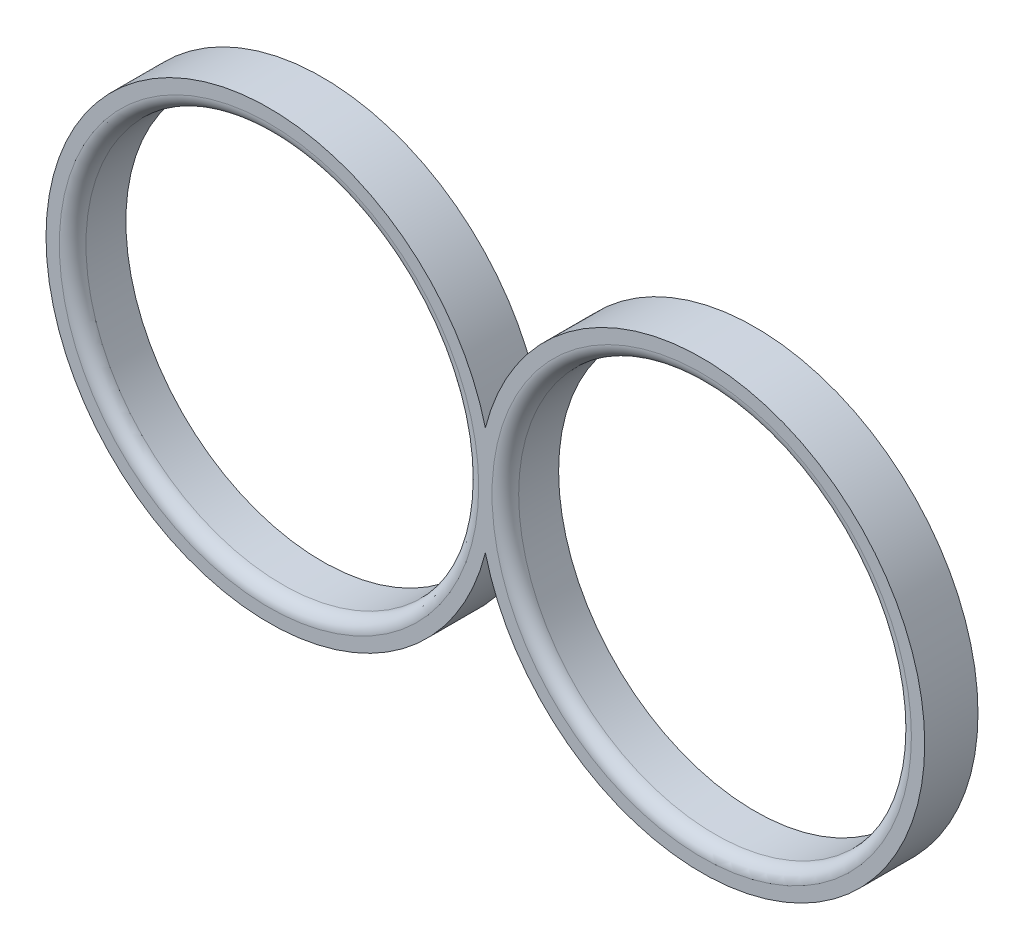
from build123d import *

# Parameters (mm, degrees)
SKETCH2_R            = 16.75
BOSS_EXTRUDE2_DEPTH  = 4
SKETCH1_R            = 14.75
CUT_EXTRUDE1_DEPTH   = 20
FILLET1_R            = 1
FILLET1_OF_MIRROR5_R = 1


with BuildPart() as part:
    # Sketch2 → Boss-Extrude2 (new body)
    with BuildSketch(Plane.XY):
        Circle(SKETCH2_R)
    boss_extrude2 = extrude(amount=BOSS_EXTRUDE2_DEPTH)

    # Sketch1 → Cut-Extrude1 (cut)
    with BuildSketch(Plane.XY):
        Circle(SKETCH1_R)
    cut_extrude1 = extrude(amount=CUT_EXTRUDE1_DEPTH, mode=Mode.SUBTRACT)

    # Fillet1
    fillet1_edges = [part.edges().sort_by_distance(p)[0] for p in [
        (-14.75, 0, 4),
    ]]
    fillet(fillet1_edges, radius=FILLET1_R)

    # Mirror5: Boss-Extrude2, Cut-Extrude1 across plane
    add(boss_extrude2.mirror(Plane(origin=(16.25, 0, 0), x_dir=(0, 0, 1), z_dir=(1, 0, 0))))
    add(cut_extrude1.mirror(Plane(origin=(16.25, 0, 0), x_dir=(0, 0, 1), z_dir=(1, 0, 0))), mode=Mode.SUBTRACT)

    # Fillet1 of Mirror5
    fillet1_of_mirror5_edges = [part.edges().sort_by_distance(p)[0] for p in [
        (47.25, 0, 4),
    ]]
    fillet(fillet1_of_mirror5_edges, radius=FILLET1_OF_MIRROR5_R)


solid = part.part
